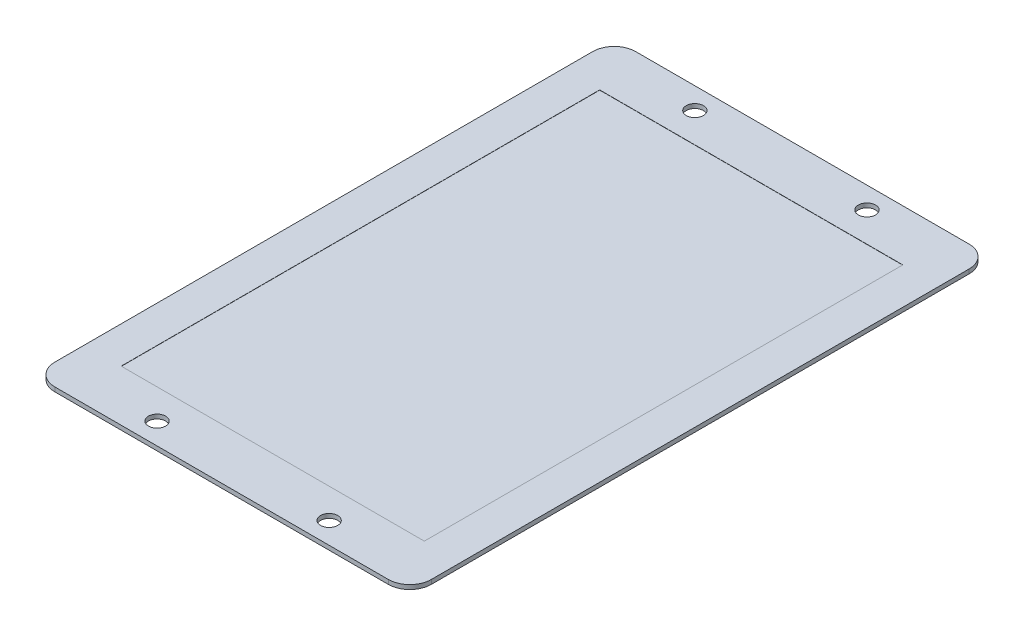
from build123d import *

# Parameters (mm, degrees)
SKETCH_2_W          = 175
SKETCH_2_H          = 270
EXTRUDE_1_DEPTH     = 2
FILLET_1_R          = 10
SKETCH_3_R          = 4
CUT_EXTRUDE_1_DEPTH = 161.888936848
SKETCH_4_W          = 140.906747132
SKETCH_4_H          = 222.417825068
CUT_EXTRUDE_2_DEPTH = 0.1
SKETCH_5_W          = 45
SKETCH_5_H          = 40
EXTRUDE_2_DEPTH     = 15
FILLET_2_R          = 2


with BuildPart() as part:
    # 草图2 → 凸台-拉伸1 (new body)
    with BuildSketch(Plane(origin=(0, 0, 0), x_dir=(1, 0, 0), z_dir=(0, 1, 0))):
        Rectangle(SKETCH_2_W, SKETCH_2_H)
    extrude(amount=EXTRUDE_1_DEPTH)

    # 圆角1
    fillet_1_edges = [part.edges().sort_by_distance(p)[0] for p in [
        (87.5, 1, 135),
        (-87.5, 1, 135),
        (-87.5, 1, -135),
        (87.5, 1, -135),
    ]]
    fillet(fillet_1_edges, radius=FILLET_1_R)

    # 草图3 → 切除-拉伸1 (cut, through all)
    with BuildSketch(Plane(origin=(0, 2, 0), x_dir=(1, 0, 0), z_dir=(0, 1, 0))):
        with Locations(Location((-40, 125, 0), (0, 0, 270))):
            Circle(SKETCH_3_R)
        with Locations(Location((40, 125, 0), (0, 0, 270))):
            Circle(SKETCH_3_R)
        with Locations(Location((40, -125, 0), (0, 0, 270))):
            Circle(SKETCH_3_R)
        with Locations(Location((-40, -125, 0), (0, 0, 270))):
            Circle(SKETCH_3_R)
    extrude(amount=-CUT_EXTRUDE_1_DEPTH, mode=Mode.SUBTRACT)

    # 草图4 → 切除-拉伸2 (cut)
    with BuildSketch(Plane(origin=(0, 2, 0), x_dir=(1, 0, 0), z_dir=(0, 1, 0))):
        Rectangle(SKETCH_4_W, SKETCH_4_H)
    extrude(amount=-CUT_EXTRUDE_2_DEPTH, mode=Mode.SUBTRACT)

    # 草图5 → 凸台-拉伸2 (add)
    with BuildSketch(Plane.XZ):
        with Locations((20, 0)):
            Rectangle(SKETCH_5_W, SKETCH_5_H)
    extrude(amount=EXTRUDE_2_DEPTH)

    # 圆角2
    fillet_2_edges = [part.edges().sort_by_distance(p)[0] for p in [
        (-2.5, -7.5, 20),
        (-2.5, -7.5, -20),
        (42.5, -7.5, -20),
        (42.5, -7.5, 20),
        (-2.5, -15, 0),
        (20, -15, -20),
        (42.5, -15, 0),
        (20, -15, 20),
    ]]
    fillet(fillet_2_edges, radius=FILLET_2_R)


solid = part.part
